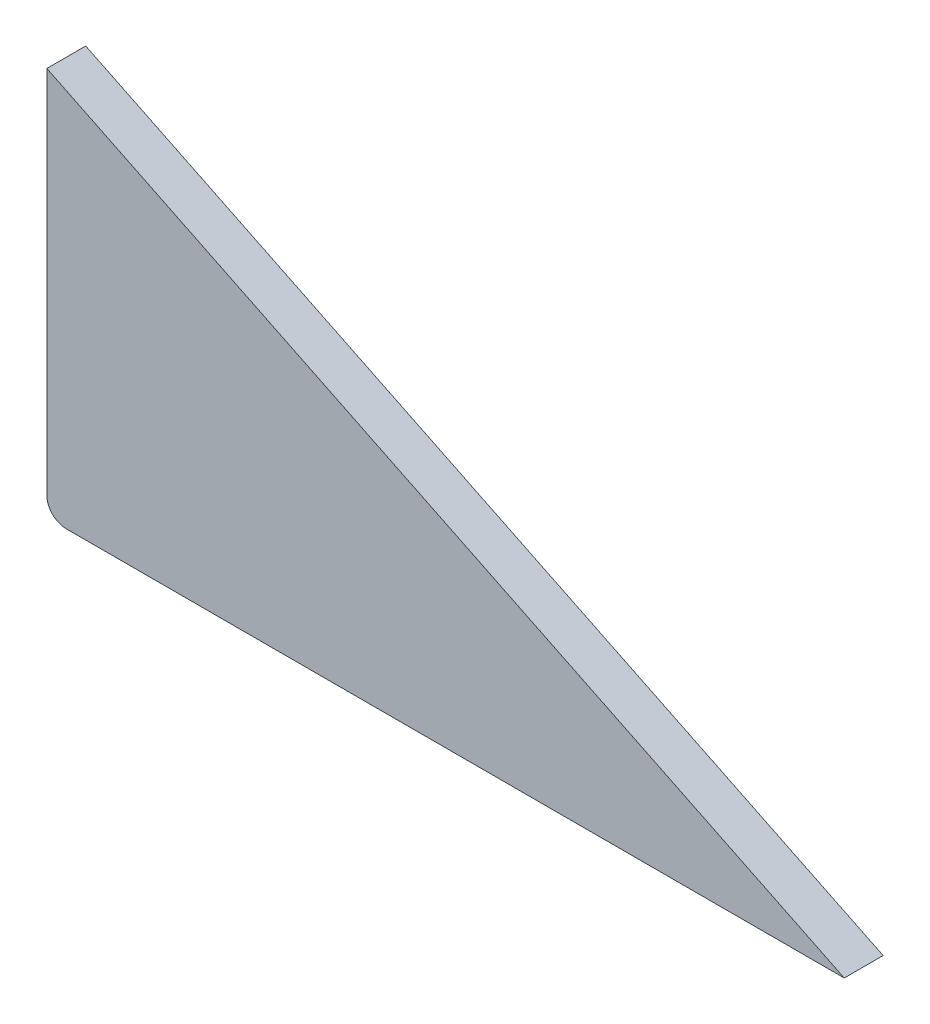
from build123d import *

# Parameters (mm, degrees)
BOSS_EXTRUDE1_DEPTH = 6.35
FILLET1_R           = 3.175


with BuildPart() as part:
    # Sketch2 → Boss-Extrude1 (new body)
    with BuildSketch(Plane.XY):
        Polygon((0, 0), (130.175, 0), (0, 63.5), align=None)
    extrude(amount=BOSS_EXTRUDE1_DEPTH)

    # Fillet1
    fillet1_edges = [part.edges().sort_by_distance(p)[0] for p in [
        (0, 0, 3.175),
    ]]
    fillet(fillet1_edges, radius=FILLET1_R)


solid = part.part
